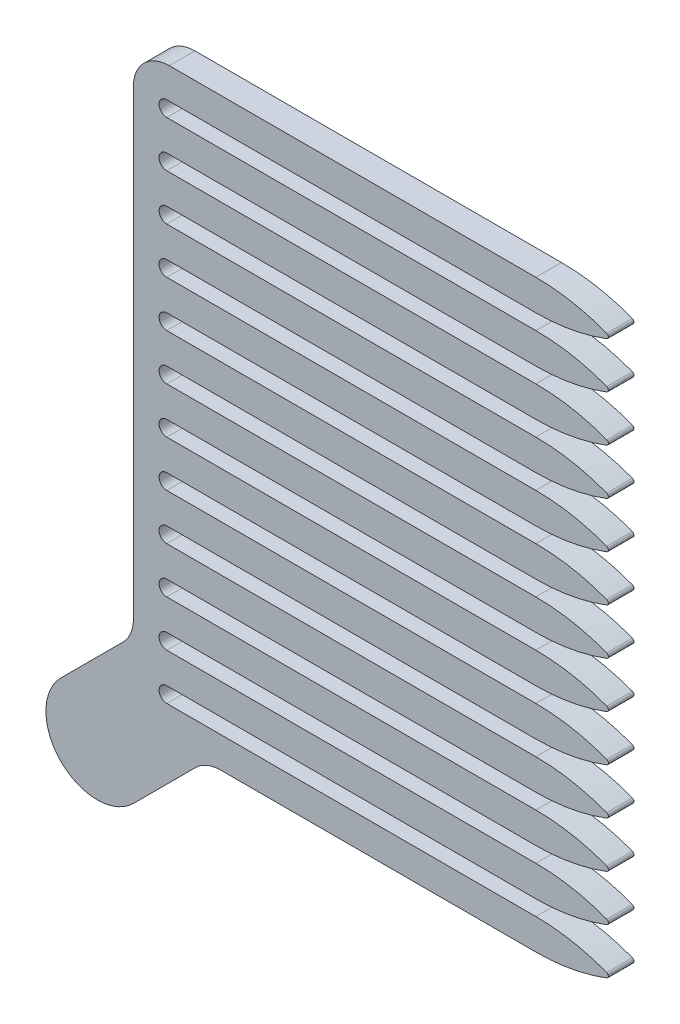
from build123d import *

# Parameters (mm, degrees)
AUFSATZ_LINEAR_AUSTRAGEN1_DEPTH = 5
SKIZZE2_R                       = 1.5
SCHNITT_LINEAR_AUSTRAGEN1_DEPTH = 79.887578236
VERRUNDUNG2_R                   = 0.5
LINEARES_MUSTER1_COUNT          = 13
LINEARES_MUSTER1_PITCH          = 9
SKIZZE3_W                       = 7.361940712
SKIZZE3_H                       = 3
SCHNITT_LINEAR_AUSTRAGEN2_DEPTH = 139.503610204
AUFSATZ_LINEAR_AUSTRAGEN2_DEPTH = 5
VERRUNDUNG1_R                   = 7


with BuildPart() as part:
    # Skizze1 → Aufsatz-Linear austragen1 (new body)
    with BuildSketch(Plane.XY):
        with BuildLine():
            Line((0, 3), (-78.5, 3))
            Line((-78.5, 3), (-78.5, -1.933446409))
            Line((-78.5, -1.933446409), (-78.5, -6))
            Line((-78.5, -6), (-72, -6))
            Line((-72, -6), (-72, -3))
            Line((-72, -3), (0, -3))
            ThreePointArc((0, -3), (7.64852927, -2.242646352), (15, 0))
            ThreePointArc((15, 0), (7.64852927, 2.242646352), (0, 3))
        make_face()
    extrude(amount=AUFSATZ_LINEAR_AUSTRAGEN1_DEPTH)

    # Skizze2 → Schnitt-Linear austragen1 (cut, through all)
    with BuildSketch(Plane.XY.offset(5)):
        with Locations((-72, -4.5)):
            Circle(SKIZZE2_R)
    extrude(amount=-SCHNITT_LINEAR_AUSTRAGEN1_DEPTH, mode=Mode.SUBTRACT)

    # Verrundung2
    verrundung2_edges = [part.edges().sort_by_distance(p)[0] for p in [
        (15, 0, 2.5),
    ]]
    fillet(verrundung2_edges, radius=VERRUNDUNG2_R)


with BuildPart() as lineares_muster1_1:
    # Lineares Muster1: pattern copy
    add(part.part.moved(Location(Vector(0, -1, 0) * (1 * LINEARES_MUSTER1_PITCH))))


with BuildPart() as lineares_muster1_2:
    # Lineares Muster1: pattern copy
    add(part.part.moved(Location(Vector(0, -1, 0) * (2 * LINEARES_MUSTER1_PITCH))))


with BuildPart() as lineares_muster1_3:
    # Lineares Muster1: pattern copy
    add(part.part.moved(Location(Vector(0, -1, 0) * (3 * LINEARES_MUSTER1_PITCH))))


with BuildPart() as lineares_muster1_4:
    # Lineares Muster1: pattern copy
    add(part.part.moved(Location(Vector(0, -1, 0) * (4 * LINEARES_MUSTER1_PITCH))))


with BuildPart() as lineares_muster1_5:
    # Lineares Muster1: pattern copy
    add(part.part.moved(Location(Vector(0, -1, 0) * (5 * LINEARES_MUSTER1_PITCH))))


with BuildPart() as lineares_muster1_6:
    # Lineares Muster1: pattern copy
    add(part.part.moved(Location(Vector(0, -1, 0) * (6 * LINEARES_MUSTER1_PITCH))))


with BuildPart() as lineares_muster1_7:
    # Lineares Muster1: pattern copy
    add(part.part.moved(Location(Vector(0, -1, 0) * (7 * LINEARES_MUSTER1_PITCH))))


with BuildPart() as lineares_muster1_8:
    # Lineares Muster1: pattern copy
    add(part.part.moved(Location(Vector(0, -1, 0) * (8 * LINEARES_MUSTER1_PITCH))))


with BuildPart() as lineares_muster1_9:
    # Lineares Muster1: pattern copy
    add(part.part.moved(Location(Vector(0, -1, 0) * (9 * LINEARES_MUSTER1_PITCH))))


with BuildPart() as lineares_muster1_10:
    # Lineares Muster1: pattern copy
    add(part.part.moved(Location(Vector(0, -1, 0) * (10 * LINEARES_MUSTER1_PITCH))))


with BuildPart() as lineares_muster1_11:
    # Lineares Muster1: pattern copy
    add(part.part.moved(Location(Vector(0, -1, 0) * (11 * LINEARES_MUSTER1_PITCH))))


with BuildPart() as lineares_muster1_12:
    # Lineares Muster1: pattern copy
    add(part.part.moved(Location(Vector(0, -1, 0) * (12 * LINEARES_MUSTER1_PITCH))))


with BuildPart() as part_1:
    add(part.part)

    # Kombinieren1: union Lineares Muster1_1, Lineares Muster1_2, Lineares Muster1_3, Lineares Muster1_4, Lineares Muster1_5, Lineares Muster1_6, Lineares Muster1_7, Lineares Muster1_8, Lineares Muster1_9, Lineares Muster1_10, Lineares Muster1_11, Lineares Muster1_12
    add(lineares_muster1_1.part)
    add(lineares_muster1_2.part)
    add(lineares_muster1_3.part)
    add(lineares_muster1_4.part)
    add(lineares_muster1_5.part)
    add(lineares_muster1_6.part)
    add(lineares_muster1_7.part)
    add(lineares_muster1_8.part)
    add(lineares_muster1_9.part)
    add(lineares_muster1_10.part)
    add(lineares_muster1_11.part)
    add(lineares_muster1_12.part)

    # Skizze3 → Schnitt-Linear austragen2 (cut, through all)
    with BuildSketch(Plane.XY.offset(5)):
        with Locations((-74.819029644, -112.5)):
            Rectangle(SKIZZE3_W, SKIZZE3_H)
    extrude(amount=-SCHNITT_LINEAR_AUSTRAGEN2_DEPTH, mode=Mode.SUBTRACT)

    # Skizze4 → Aufsatz-Linear austragen2 (add)
    with BuildSketch(Plane.XY.offset(5)):
        with BuildLine():
            Line((-64.357864376, -111), (-78.5, -111))
            Line((-78.5, -111), (-78.5, -96.857864376))
            Line((-78.5, -96.857864376), (-92.642135624, -111))
            ThreePointArc((-92.642135624, -111), (-92.642135624, -125.142135624), (-78.5, -125.142135624))
            Line((-78.5, -125.142135624), (-64.357864376, -111))
        make_face()
    extrude(amount=-AUFSATZ_LINEAR_AUSTRAGEN2_DEPTH)

    # Verrundung1
    verrundung1_edges = [part_1.edges().sort_by_distance(p)[0] for p in [
        (-78.5, 3, 2.5),
        (-64.357864376, -111, 2.5),
        (-78.5, -96.857864376, 2.5),
    ]]
    fillet(verrundung1_edges, radius=VERRUNDUNG1_R)


solid = part_1.part
